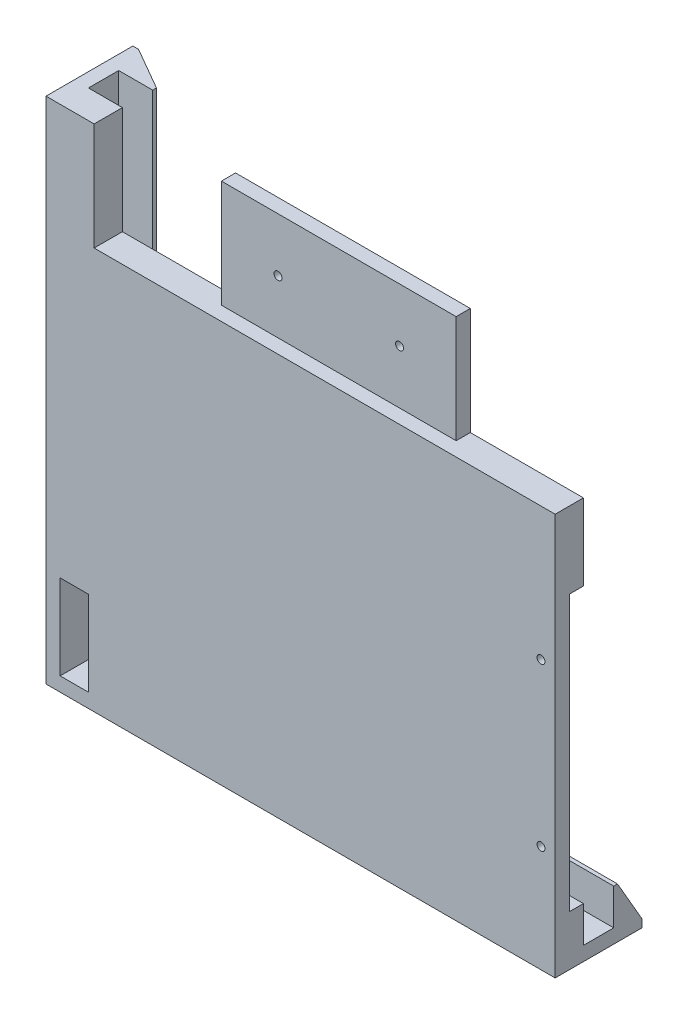
from build123d import *

# Parameters (mm, degrees)
CROQUIS1_W              = 180
CROQUIS1_H              = 180
SALIENTE_EXTRUIR1_DEPTH = 30.7
CROQUIS2_W              = 162.99
CROQUIS2_H              = 162.21
CORTAR_EXTRUIR1_DEPTH   = 20.7
CROQUIS4_W              = 175
CROQUIS4_H              = 10.7
CORTAR_EXTRUIR2_DEPTH   = 175
CROQUIS5_W              = 40
CROQUIS5_H              = 38
CORTAR_EXTRUIR3_DEPTH   = 10
CROQUIS6_W              = 82.99
CROQUIS6_H              = 38
CORTAR_EXTRUIR4_DEPTH   = 5
CROQUIS7_W              = 10
CROQUIS7_H              = 97.21
CORTAR_EXTRUIR5_DEPTH   = 5
CROQUIS8_W              = 10
CROQUIS8_H              = 30
CORTAR_EXTRUIR6_DEPTH   = 20
CROQUIS9_R              = 1.4
CORTAR_EXTRUIR7_DEPTH   = 20
CHAFL_N1_SIZE           = 15
CHAFL_N1_SIZE2          = 8.660254038


with BuildPart() as part:
    # Croquis1 → Saliente-Extruir1 (new body)
    with BuildSketch(Plane.XY):
        with Locations((90, 90)):
            Rectangle(CROQUIS1_W, CROQUIS1_H)
    extrude(amount=SALIENTE_EXTRUIR1_DEPTH)

    # Croquis2 → Cortar-Extruir1 (cut)
    with BuildSketch(Plane(origin=(0, 0, 0), x_dir=(-1, 0, 0), z_dir=(0, 0, -1))):
        with Locations((-98.505, 98.895)):
            Rectangle(CROQUIS2_W, CROQUIS2_H)
    extrude(amount=-CORTAR_EXTRUIR1_DEPTH, mode=Mode.SUBTRACT)

    # Croquis4 → Cortar-Extruir2 (cut)
    with BuildSketch(Plane(origin=(0, 180, 0), x_dir=(1, 0, 0), z_dir=(0, 1, 0))):
        with Locations((92.5, -15.35)):
            Rectangle(CROQUIS4_W, CROQUIS4_H)
    extrude(amount=-CORTAR_EXTRUIR2_DEPTH, mode=Mode.SUBTRACT)

    # Croquis5 → Cortar-Extruir3 (cut)
    with BuildSketch(Plane(origin=(0, 0, 20.7), x_dir=(-1, 0, 0), z_dir=(0, 0, -1))):
        with Locations((-160, 161)):
            Rectangle(CROQUIS5_W, CROQUIS5_H)
        with Locations((-37.01, 161)):
            Rectangle(CROQUIS5_W, CROQUIS5_H)
    extrude(amount=-CORTAR_EXTRUIR3_DEPTH, mode=Mode.SUBTRACT)

    # Croquis6 → Cortar-Extruir4 (cut)
    with BuildSketch(Plane.XY.offset(30.7)):
        with Locations((98.505, 161)):
            Rectangle(CROQUIS6_W, CROQUIS6_H)
    extrude(amount=-CORTAR_EXTRUIR4_DEPTH, mode=Mode.SUBTRACT)

    # Croquis7 → Cortar-Extruir5 (cut)
    with BuildSketch(Plane(origin=(0, 0, 20.7), x_dir=(-1, 0, 0), z_dir=(0, 0, -1))):
        with Locations((-175, 66.395)):
            Rectangle(CROQUIS7_W, CROQUIS7_H)
    extrude(amount=-CORTAR_EXTRUIR5_DEPTH, mode=Mode.SUBTRACT)

    # Croquis8 → Cortar-Extruir6 (cut)
    with BuildSketch(Plane(origin=(0, 0, 20.7), x_dir=(-1, 0, 0), z_dir=(0, 0, -1))):
        with Locations((-10, 20)):
            Rectangle(CROQUIS8_W, CROQUIS8_H)
    extrude(amount=-CORTAR_EXTRUIR6_DEPTH, mode=Mode.SUBTRACT)

    # Croquis9 → Cortar-Extruir7 (cut)
    with BuildSketch(Plane(origin=(0, 0, 20.7), x_dir=(-1, 0, 0), z_dir=(0, 0, -1))):
        with Locations((-120, 161)):
            Circle(CROQUIS9_R)
        with Locations((-77.01, 161)):
            Circle(CROQUIS9_R)
        with Locations((-175, 95)):
            Circle(CROQUIS9_R)
        with Locations((-175, 37.79)):
            Circle(CROQUIS9_R)
    extrude(amount=-CORTAR_EXTRUIR7_DEPTH, mode=Mode.SUBTRACT)

    # Chaflán1
    chafl_n1_edges = [part.edges().sort_by_distance(p)[0] for p in [
        (98.505, 17.79, 0),
        (17.01, 98.895, 0),
    ]]
    chafl_n1_side = [part.faces().sort_by_distance(p)[0] for p in [
        (2.545584412, 90, 0),
    ]]
    chamfer(chafl_n1_edges, length=CHAFL_N1_SIZE, length2=CHAFL_N1_SIZE2, reference=chafl_n1_side[0])


solid = part.part
